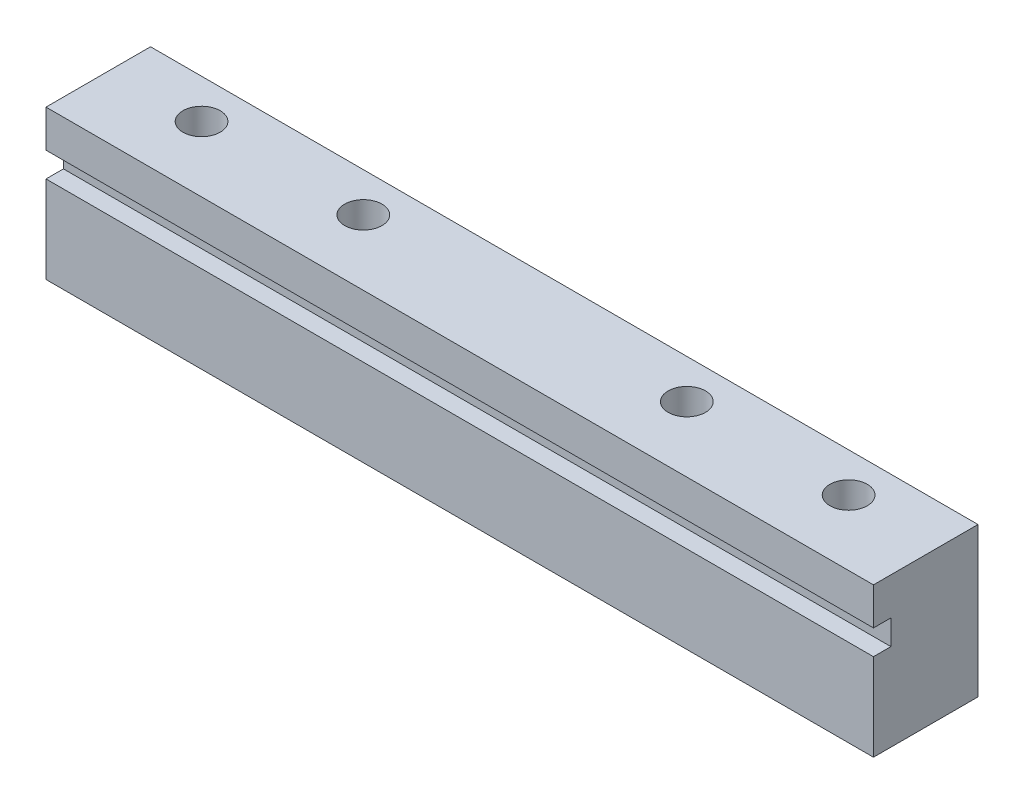
from build123d import *

# Parameters (mm, degrees)
SKETCH_1_W          = 66.5
SKETCH_1_H          = 8.4
EXTRUDE_1_DEPTH     = 12
SKETCH_2_W          = 1.4
SKETCH_2_H          = 2
CUT_EXTRUDE_1_DEPTH = 104
SKETCH_4_R          = 1.5
CUT_EXTRUDE_3_DEPTH = 36.597787853


with BuildPart() as part:
    # 草图1 → 凸台-拉伸1 (new body)
    with BuildSketch(Plane(origin=(0, 0, 0), x_dir=(1, 0, 0), z_dir=(0, 1, 0))):
        Rectangle(SKETCH_1_W, SKETCH_1_H)
    extrude(amount=EXTRUDE_1_DEPTH)

    # 草图2 → 切除-拉伸1 (cut)
    with BuildSketch(Plane(origin=(33.25, 0, 0), x_dir=(0, 0, -1), z_dir=(1, 0, 0))):
        with Locations((-3.5, 8)):
            Rectangle(SKETCH_2_W, SKETCH_2_H)
    extrude(amount=-CUT_EXTRUDE_1_DEPTH, mode=Mode.SUBTRACT)

    # 草图4 → 切除-拉伸3 (cut, through all)
    with BuildSketch(Plane.XZ):
        with Locations(Location((-26, -1.05, 0), (0, 0, 270))):
            Circle(SKETCH_4_R)
        with Locations(Location((-13, -1.05, 0), (0, 0, 270))):
            Circle(SKETCH_4_R)
        with Locations(Location((26, -1.05, 0), (0, 0, 270))):
            Circle(SKETCH_4_R)
        with Locations(Location((13, -1.05, 0), (0, 0, 270))):
            Circle(SKETCH_4_R)
    extrude(amount=-CUT_EXTRUDE_3_DEPTH, mode=Mode.SUBTRACT)


solid = part.part
